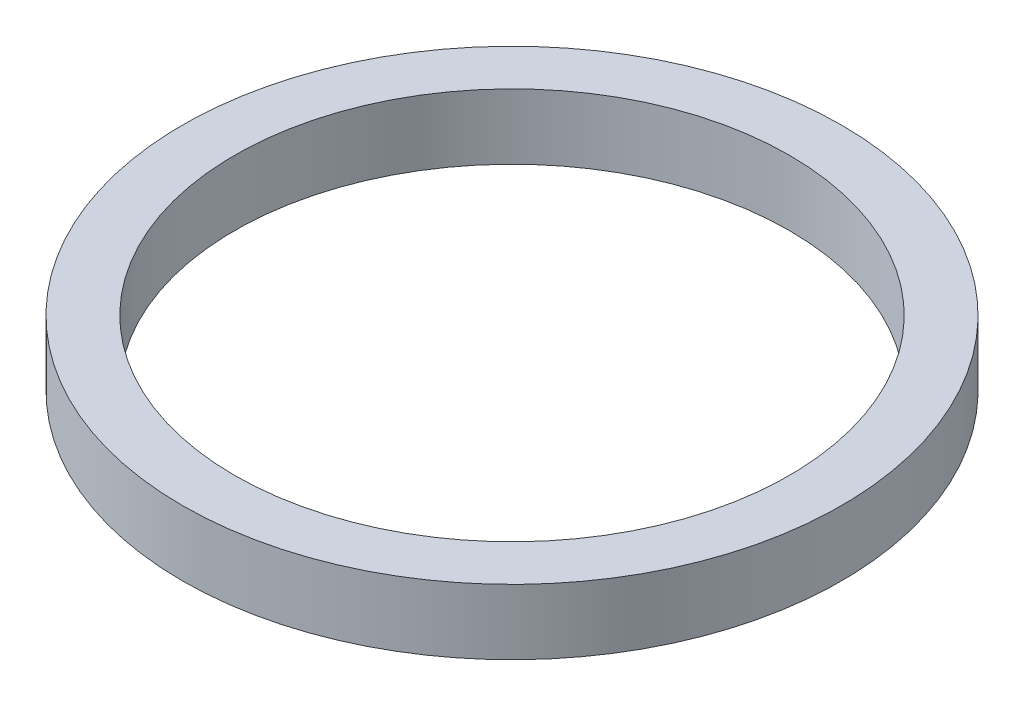
from build123d import *

# Parameters (mm, degrees)
CROQUIS1_R              = 25.25
CROQUIS1_R_2            = 21.25
SALIENTE_EXTRUIR1_DEPTH = 5


with BuildPart() as part:
    # Croquis1 → Saliente-Extruir1 (new body)
    with BuildSketch(Plane(origin=(0, 0, 0), x_dir=(1, 0, 0), z_dir=(0, 1, 0))):
        with Locations(Location((0, 0, 0), (0, 0, 270))):
            Circle(CROQUIS1_R)
        with Locations(Location((0, 0, 0), (0, 0, 270))):
            Circle(CROQUIS1_R_2, mode=Mode.SUBTRACT)
    extrude(amount=SALIENTE_EXTRUIR1_DEPTH)


solid = part.part
